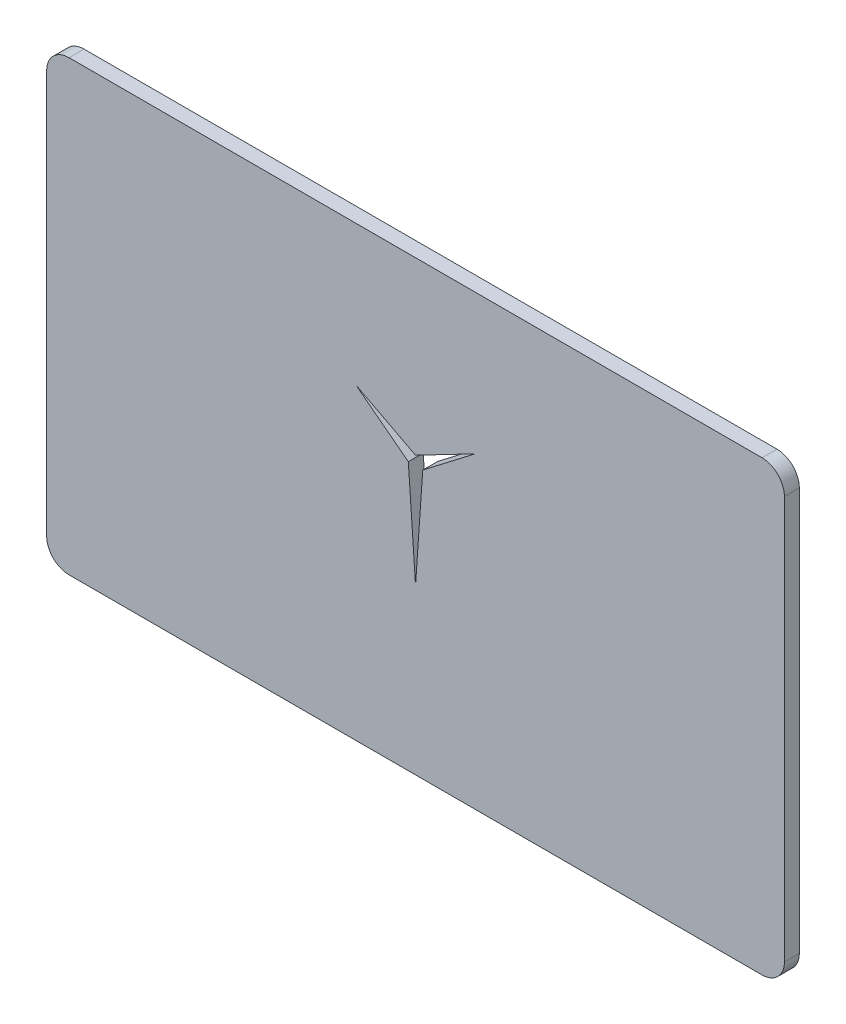
from build123d import *

# Parameters (mm, degrees)
EXTRUDE_1_DEPTH = 2


with BuildPart() as part:
    # 草图1 → 凸台-拉伸1 (new body)
    with BuildSketch(Plane.XY):
        with BuildLine():
            Line((-46.414552668, 30), (46.414552668, 30))
            ThreePointArc((46.414552668, 30), (48.535873012, 29.121320344), (49.414552668, 27))
            Line((49.414552668, 27), (49.414552668, -27))
            ThreePointArc((49.414552668, -27), (48.535873012, -29.121320344), (46.414552668, -30))
            Line((46.414552668, -30), (-46.414552668, -30))
            ThreePointArc((-46.414552668, -30), (-48.535873012, -29.121320344), (-49.414552668, -27))
            Line((-49.414552668, -27), (-49.414552668, 27))
            ThreePointArc((-49.414552668, 27), (-48.535873012, 29.121320344), (-46.414552668, 30))
        make_face()
        Polygon((0, -8), (-0.96882521, 5.854845987), (-8, 11.250056161), (0, 7.085519757), (8, 11.250056161), (0.96882521, 5.854845987), align=None, mode=Mode.SUBTRACT)
    extrude(amount=EXTRUDE_1_DEPTH)


solid = part.part
